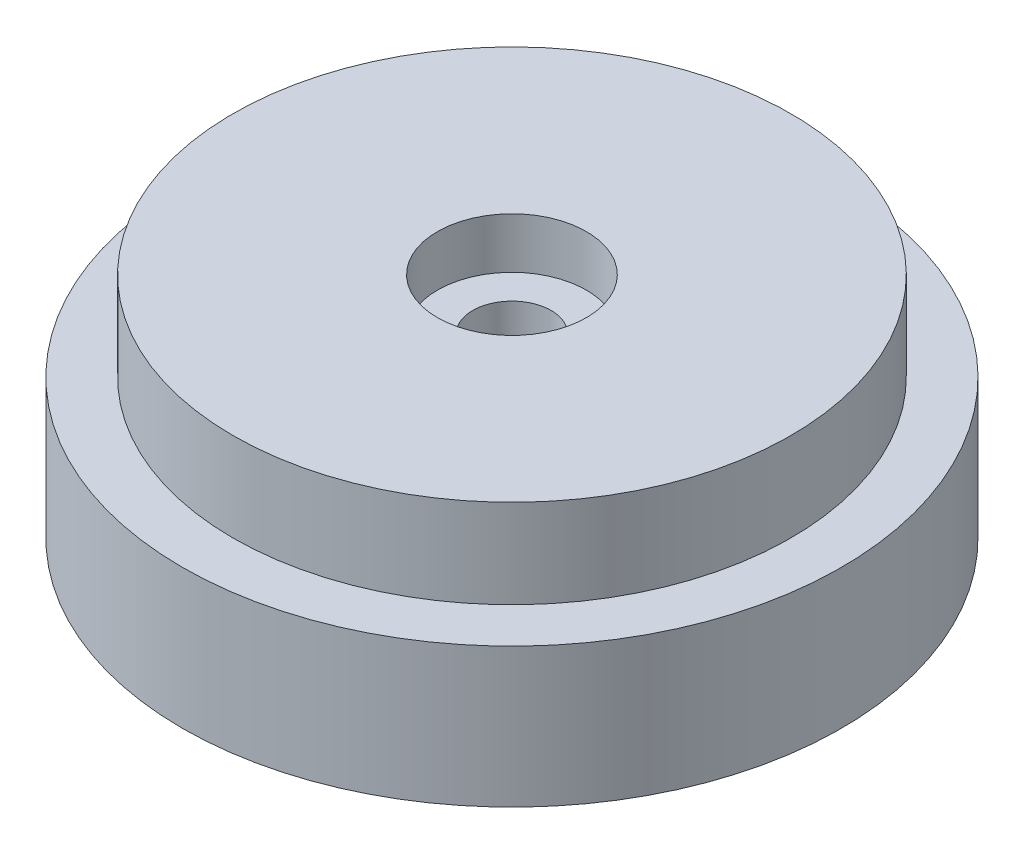
from build123d import *

# Parameters (mm, degrees)
SKETCH2_R           = 11
SKETCH2_R_2         = 2.94
BOSS_EXTRUDE1_DEPTH = 9
SKETCH2_3_R         = 2.94
SKETCH2_3_R_2       = 1.55
BOSS_EXTRUDE2_DEPTH = 7
SKETCH2_4_R         = 2.94
SKETCH2_4_R_2       = 1.55
CUT_EXTRUDE1_DEPTH  = 3
SKETCH2_6_R         = 3.05
CUT_EXTRUDE2_DEPTH  = 8.6
SKETCH2_7_R         = 13
SKETCH2_7_R_2       = 11
BOSS_EXTRUDE3_DEPTH = 5.5


with BuildPart() as part:
    # Sketch2 → Boss-Extrude1 (new body)
    with BuildSketch(Plane(origin=(0, 0, 0), x_dir=(1, 0, 0), z_dir=(0, 1, 0))):
        with Locations(Location((0, 0, 0), (0, 0, 270))):
            Circle(SKETCH2_R)
        with Locations(Location((0, 0, 0), (0, 0, 270))):
            Circle(SKETCH2_R_2, mode=Mode.SUBTRACT)
    extrude(amount=BOSS_EXTRUDE1_DEPTH)

    # Sketch2<3> → Boss-Extrude2 (add)
    with BuildSketch(Plane(origin=(0, 0, 0), x_dir=(1, 0, 0), z_dir=(0, 1, 0))):
        with Locations(Location((0, 0, 0), (0, 0, 270))):
            Circle(SKETCH2_3_R)
        with Locations(Location((0, 0, 0), (0, 0, 270))):
            Circle(SKETCH2_3_R_2, mode=Mode.SUBTRACT)
    extrude(amount=BOSS_EXTRUDE2_DEPTH)

    # Sketch2<4> → Cut-Extrude1 (cut)
    with BuildSketch(Plane(origin=(0, 0, 0), x_dir=(1, 0, 0), z_dir=(0, 1, 0))):
        with Locations(Location((0, 0, 0), (0, 0, 270))):
            Circle(SKETCH2_4_R)
        with Locations(Location((0, 0, 0), (0, 0, 270))):
            Circle(SKETCH2_4_R_2, mode=Mode.SUBTRACT)
    extrude(amount=CUT_EXTRUDE1_DEPTH, mode=Mode.SUBTRACT)

    # Sketch2<6> → Cut-Extrude2 (cut)
    with BuildSketch(Plane(origin=(0, 0, 0), x_dir=(1, 0, 0), z_dir=(0, 1, 0))):
        with Locations(Location((5, 5, 0), (0, 0, 90))):
            Circle(SKETCH2_6_R)
        with Locations(Location((5, -5, 0), (0, 0, 90))):
            Circle(SKETCH2_6_R)
        with Locations(Location((-5, -5, 0), (0, 0, 90))):
            Circle(SKETCH2_6_R)
        with Locations(Location((-5, 5, 0), (0, 0, 90))):
            Circle(SKETCH2_6_R)
    extrude(amount=CUT_EXTRUDE2_DEPTH, mode=Mode.SUBTRACT)

    # Sketch2<7> → Boss-Extrude3 (add)
    with BuildSketch(Plane(origin=(0, 0, 0), x_dir=(1, 0, 0), z_dir=(0, 1, 0))):
        with Locations(Location((0, 0, 0), (0, 0, 270))):
            Circle(SKETCH2_7_R)
        with Locations(Location((0, 0, 0), (0, 0, 270))):
            Circle(SKETCH2_7_R_2, mode=Mode.SUBTRACT)
    extrude(amount=BOSS_EXTRUDE3_DEPTH)


solid = part.part
